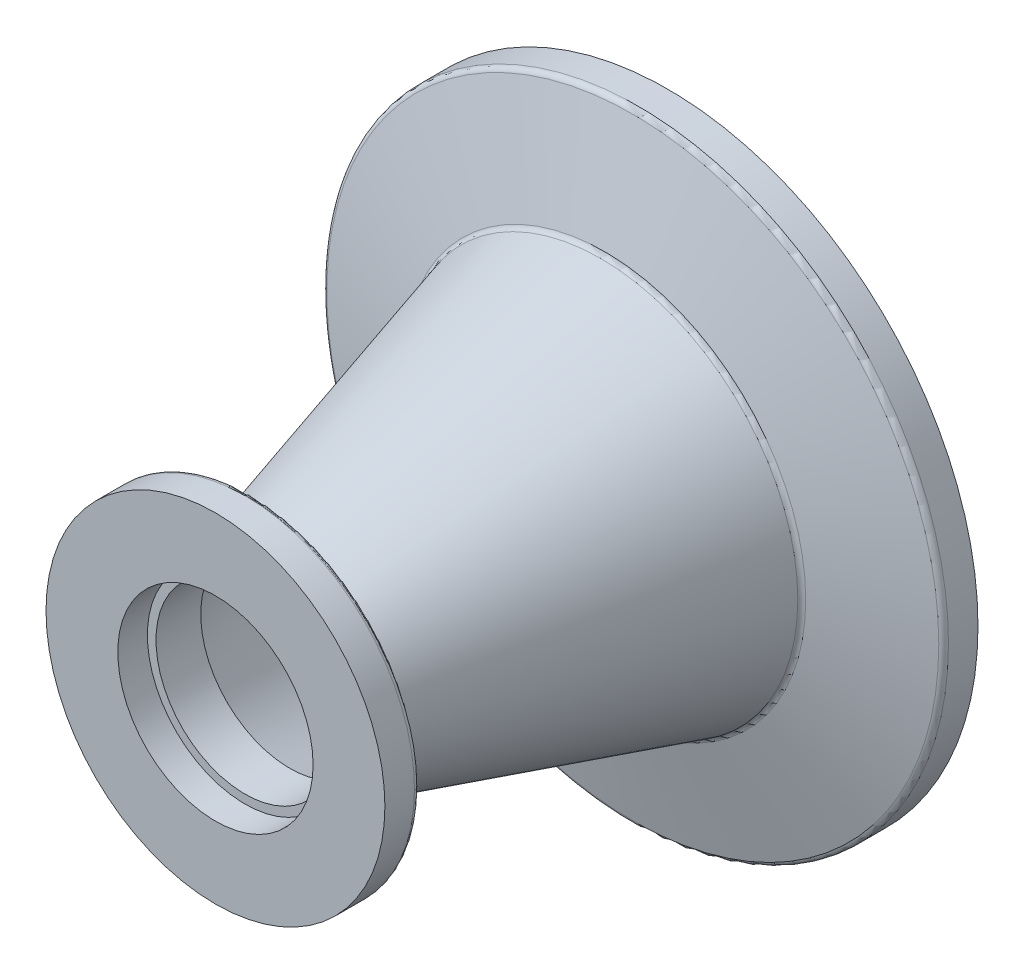
from build123d import *


with BuildPart() as part:
    # Sketch2 → Revolve1 (revolve)
    with BuildSketch(Plane(origin=(0, 0, 0), x_dir=(0, 0, -1), z_dir=(1, 0, 0)), mode=Mode.PRIVATE) as revolve1_sk:
        with BuildLine():
            Line((20.0025, 27.432), (17.388963494, 27.432))
            ThreePointArc((17.388963494, 27.432), (17.084582779, 27.32867667), (16.906000581, 27.061409523))
            Line((16.906000581, 27.061409523), (14.418444847, 17.777725139))
            ThreePointArc((14.418444847, 17.777725139), (14.291807056, 17.556374904), (14.072477617, 17.426268585))
            Line((14.072477617, 17.426268585), (-14.920169656, 9.16644804))
            ThreePointArc((-14.920169656, 9.16644804), (-15.30374952, 9.212347173), (-15.540128252, 9.517904594))
            Line((-15.540128252, 9.517904594), (-16.906000581, 14.615409523))
            ThreePointArc((-16.906000581, 14.615409523), (-17.084582779, 14.88267667), (-17.388963494, 14.986))
            Line((-17.388963494, 14.986), (-20.0025, 14.986))
            Line((-20.0025, 14.986), (-20.0025, 8.636))
            Line((-20.0025, 8.636), (-17.3863, 8.636))
            Line((-17.3863, 8.636), (-17.3863, 7.874))
            Line((-17.3863, 7.874), (-13.431030881, 7.874))
            Line((-13.431030881, 7.874), (17.3863, 16.653661283))
            Line((17.3863, 16.653661283), (17.3863, 20.6502))
            Line((17.3863, 20.6502), (20.0025, 20.6502))
            Line((20.0025, 20.6502), (20.0025, 27.432))
        make_face()
    revolve(revolve1_sk.sketch.rotate(Axis((0, 0, 20.0025), (0, 0, -1)), 90), axis=Axis((0, 0, 20.0025), (0, 0, -1)))


solid = part.part
